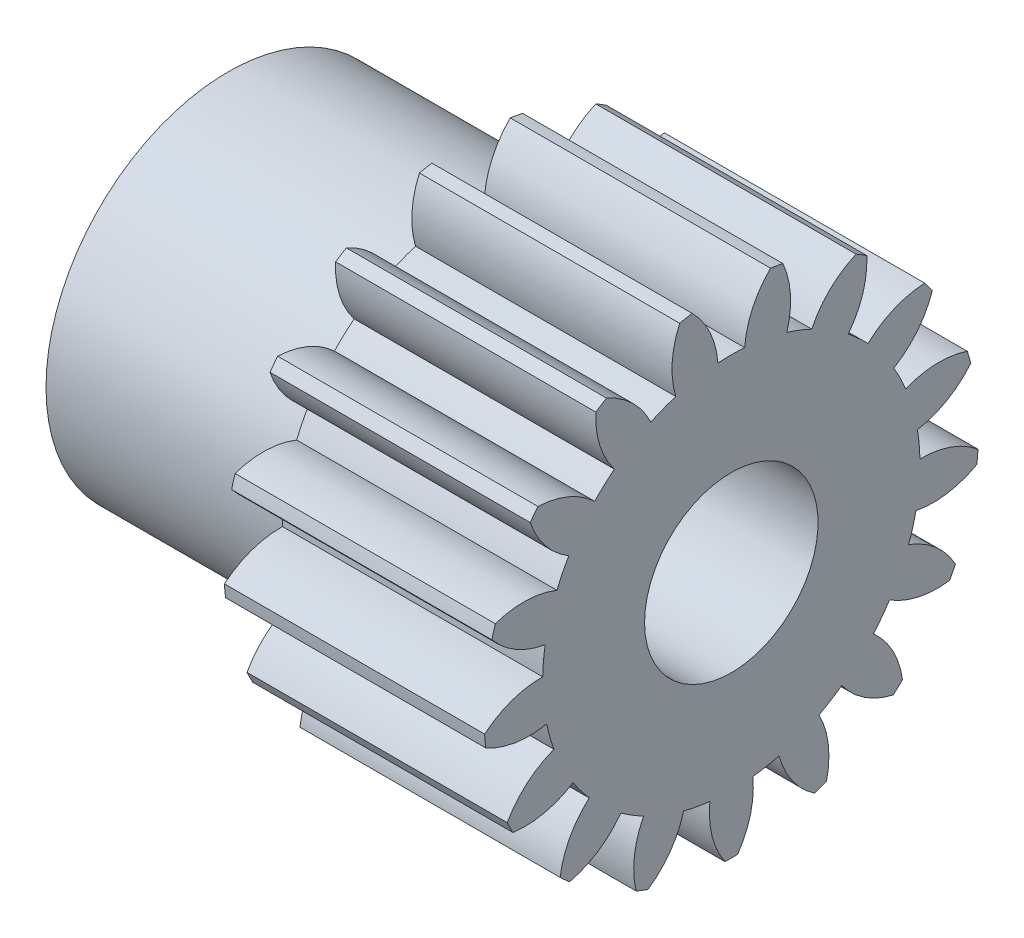
from build123d import *

# Parameters (mm, degrees)
BASPROSKE_W      = 15
BASPROSKE_H      = 14.25
TOOTHCUT_DEPTH   = 26.122201337
TEETHCUTS_COUNT  = 17
TEETHCUTS_ANGLE  = 338.823529412
HUBNEAONESKE_R   = 10.5
HUBNEARONE_DEPTH = 14.0000508
BORSKE_R         = 5
BORE_DEPTH       = 29.0000508


with BuildPart() as part:
    # BasProSke → Base-Revolve (revolve)
    with BuildSketch(Plane(origin=(0, 0, 0), x_dir=(1, 0, 0), z_dir=(0, 1, 0)), mode=Mode.PRIVATE) as base_revolve_sk:
        with Locations((7.5, 7.125)):
            Rectangle(BASPROSKE_W, BASPROSKE_H)
    revolve(base_revolve_sk.sketch.rotate(Axis((-10, 0, 0), (1, 0, 0)), 180), axis=Axis((-10, 0, 0), (1, 0, 0)))

    # TooCutSke → ToothCut (cut, through all)
    with BuildSketch(Plane(origin=(0, 0, 0), x_dir=(0, 0, -1), z_dir=(1, 0, 0))):
        with BuildLine():
            ThreePointArc((0.769354207, 10.846749287), (0, 10.874), (-0.769354207, 10.846749287))
            ThreePointArc((-0.769354207, 10.846749287), (-1.230849554, 12.606357238), (-2.280560064, 14.092057726))
            ThreePointArc((-2.280560064, 14.092057726), (0, 14.2754), (2.280560064, 14.092057726))
            ThreePointArc((2.280560064, 14.092057726), (1.230849554, 12.606357238), (0.769354207, 10.846749287))
        make_face()
    toothcut = extrude(amount=TOOTHCUT_DEPTH, mode=Mode.SUBTRACT)

    # TeethCuts: ToothCut ×17 about axis
    teethcuts_axis = Axis((-10, 0, 0), (1, 0, 0))
    for i in range(1, TEETHCUTS_COUNT):
        add(toothcut.rotate(teethcuts_axis, i * TEETHCUTS_ANGLE / (TEETHCUTS_COUNT - 1)), mode=Mode.SUBTRACT)

    # HubNeaOneSke → HubNearOne (add)
    with BuildSketch(Plane.ZY):
        with Locations(Location((0, 0, 0), (0, 0, 180))):
            Circle(HUBNEAONESKE_R)
    extrude(amount=HUBNEARONE_DEPTH)

    # BorSke → Bore (cut, symmetric)
    with BuildSketch(Plane(origin=(0, 0, 0), x_dir=(0, 0, -1), z_dir=(1, 0, 0))):
        with Locations(Location((0, 0, 0), (0, 0, 180))):
            Circle(BORSKE_R)
    extrude(amount=BORE_DEPTH, both=True, mode=Mode.SUBTRACT)


solid = part.part
